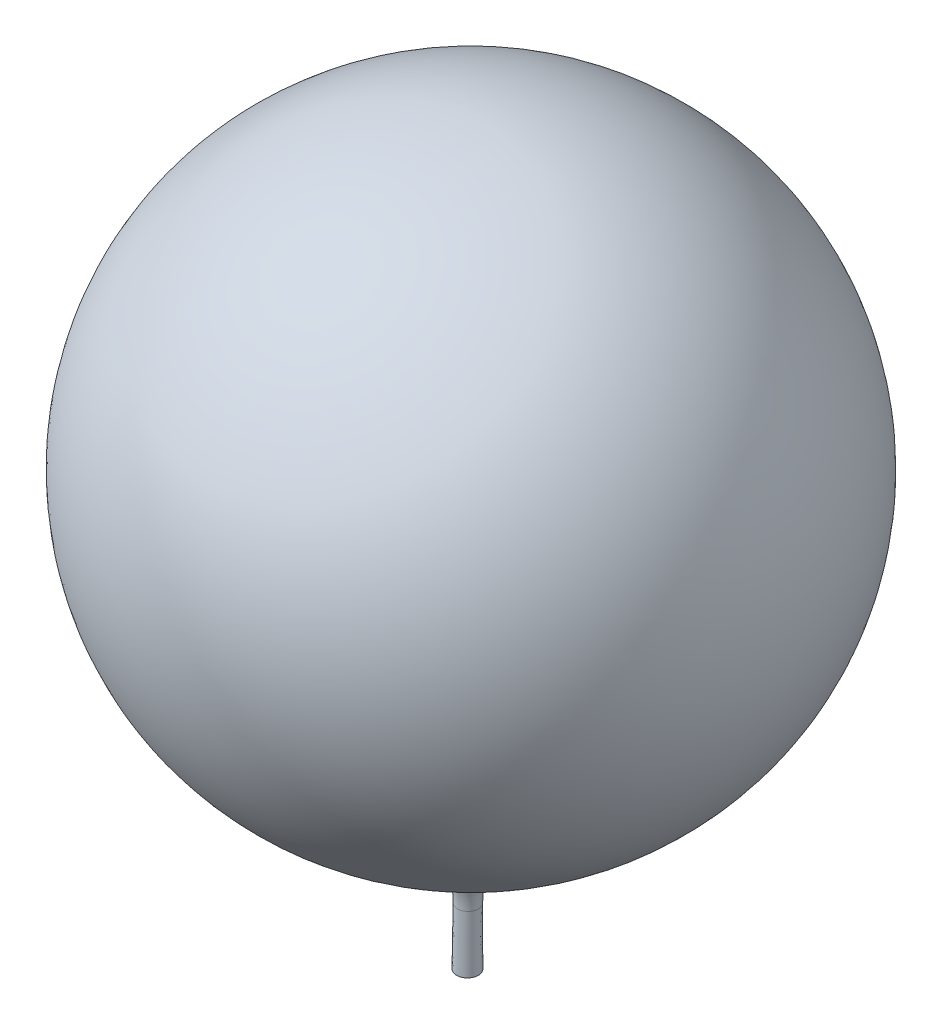
from build123d import *

# Parameters (mm, degrees)
FILLET1_R = 280


with BuildPart() as part:
    # Sketch1 → Revolve1 (revolve)
    with BuildSketch(Plane.XY, mode=Mode.PRIVATE) as revolve1_sk:
        with BuildLine():
            Line((0, 914.4), (-15, -914.276960226))
            Line((-15, -914.276960226), (-15, -1334))
            Line((-15, -1334), (15, -1334))
            Line((15, -1334), (15, -914.276960226))
            ThreePointArc((15, -914.276960226), (914.369239539, 7.500252309), (0, 914.4))
        make_face()
    revolve(revolve1_sk.sketch.rotate(Axis((0, 914.4, 0), (-0.008202375665853088, -0.9999663599508917, 0)), 180), axis=Axis((0, 914.4, 0), (-0.008202375665853088, -0.9999663599508917, 0)))

    # Fillet1
    fillet1_edges = [part.edges().sort_by_distance(p)[0] for p in [
        (15, -914.276960226, 0),
    ]]
    fillet(fillet1_edges, radius=FILLET1_R)


solid = part.part
